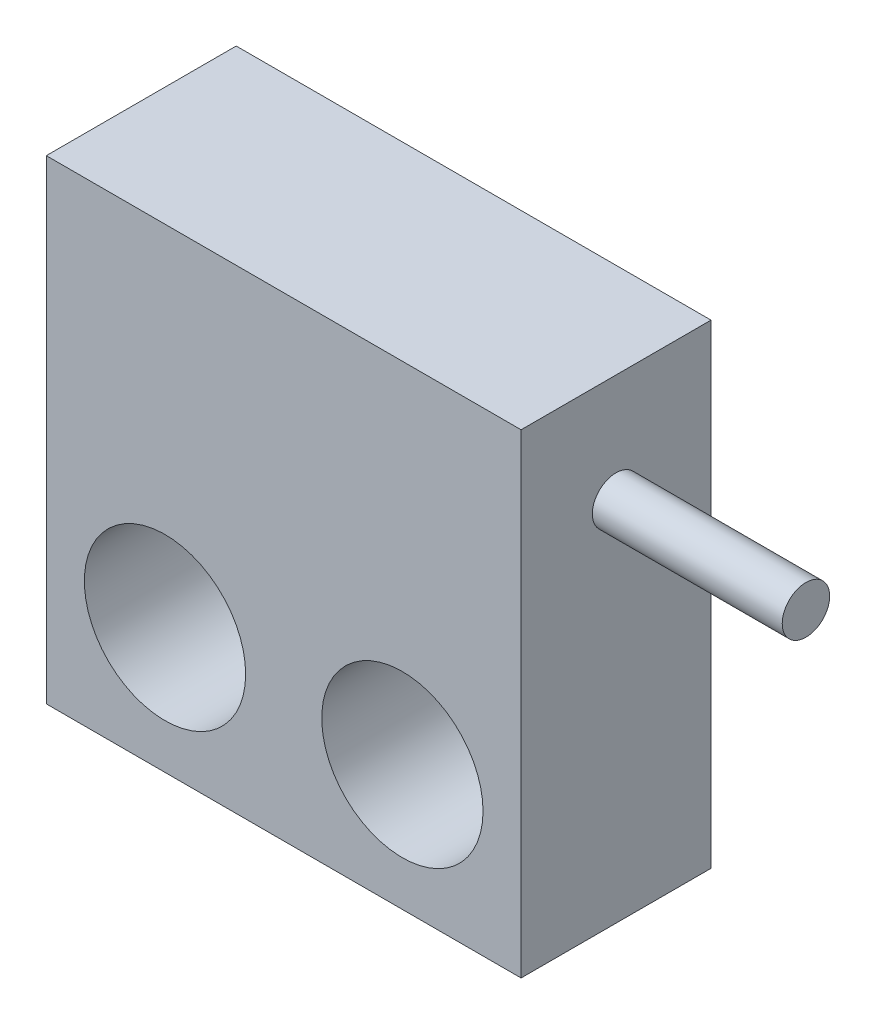
from build123d import *

# Parameters (mm, degrees)
SKETCH7_W           = 50
SKETCH7_H           = 50
SKETCH7_R           = 8.493197323
BOSS_EXTRUDE4_DEPTH = 20
SKETCH8_R           = 2.5
BOSS_EXTRUDE5_DEPTH = 20


with BuildPart() as part:
    # Sketch7 → Boss-Extrude4 (new body)
    with BuildSketch(Plane.XY):
        with Locations((25, 25)):
            Rectangle(SKETCH7_W, SKETCH7_H)
        with Locations((12.5, 13.210183113)):
            Circle(SKETCH7_R, mode=Mode.SUBTRACT)
        with Locations((37.5, 13.210183113)):
            Circle(SKETCH7_R, mode=Mode.SUBTRACT)
    extrude(amount=BOSS_EXTRUDE4_DEPTH)

    # Sketch8 → Boss-Extrude5 (add)
    with BuildSketch(Plane(origin=(50, 0, 0), x_dir=(0, 0, -1), z_dir=(1, 0, 0))):
        with Locations(Location((-10, 38.577958507, 0), (0, 0, 180))):
            Circle(SKETCH8_R)
    extrude(amount=BOSS_EXTRUDE5_DEPTH)


solid = part.part
